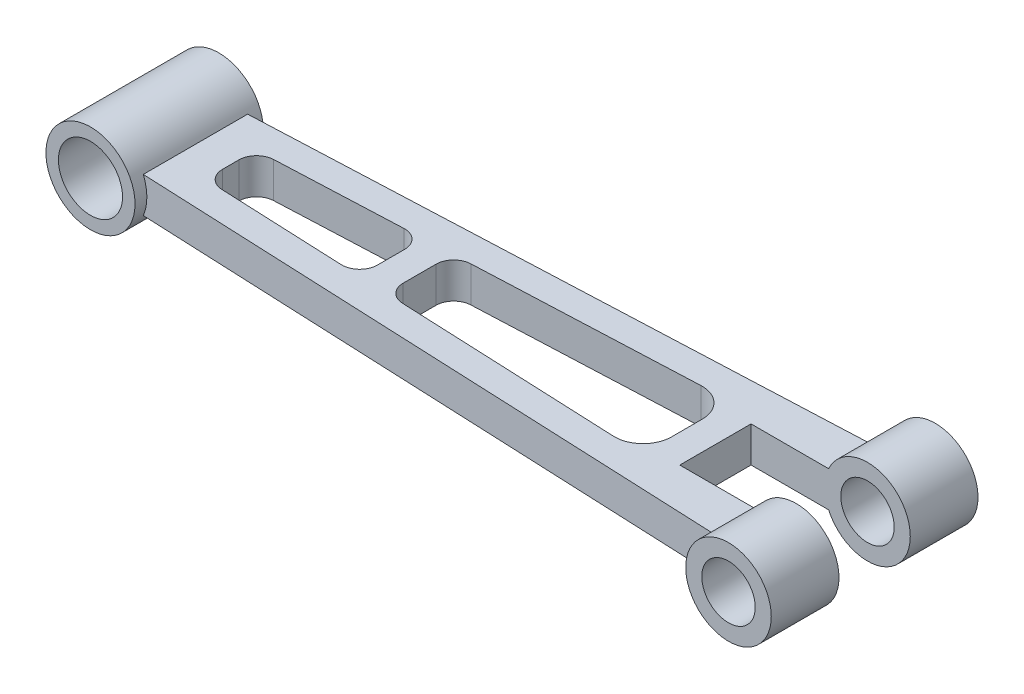
from build123d import *

# Parameters (mm, degrees)
SKETCH1_R           = 12.5
BOSS_EXTRUDE1_DEPTH = 18
SKETCH2_R           = 12
BOSS_EXTRUDE2_DEPTH = 29
BOSS_EXTRUDE4_DEPTH = 5
SKETCH7_W           = 62.580609479
SKETCH7_H           = 20
CUT_EXTRUDE2_DEPTH  = 62
CUT_EXTRUDE3_DEPTH  = 62
SKETCH9_R           = 9
SKETCH9_R_2         = 7.5
CUT_EXTRUDE4_DEPTH  = 62


with BuildPart() as part:
    # Sketch1 → Boss-Extrude1 (new, symmetric)
    with BuildSketch(Plane.XY):
        with Locations((-95, 0)):
            Circle(SKETCH1_R)
    extrude(amount=BOSS_EXTRUDE1_DEPTH, both=True)



with BuildPart() as body_2:
    # Sketch2 → Boss-Extrude2 (new, symmetric)
    with BuildSketch(Plane.XY):
        with Locations(Location((95, 0, 0), (0, 0, 180))):
            Circle(SKETCH2_R)
    extrude(amount=BOSS_EXTRUDE2_DEPTH, both=True)


with BuildPart() as part_1:
    add(part.part)

    add(body_2.part)  # Boss-Extrude4 merges body 2
    # Sketch6 → Boss-Extrude4 (add, symmetric)
    with BuildSketch(Plane(origin=(0, 0, 0), x_dir=(1, 0, 0), z_dir=(0, 1, 0))):
        Polygon((95, 22.434972483), (95, -22.434972483), (-95, -14.13939333), (-95, 14.13939333), align=None)
    extrude(amount=BOSS_EXTRUDE4_DEPTH, both=True)

    # Sketch7 → Cut-Extrude2 (cut, symmetric)
    with BuildSketch(Plane(origin=(0, 5, 0), x_dir=(1, 0, 0), z_dir=(0, 1, 0))):
        with Locations((93.62091422, 0)):
            Rectangle(SKETCH7_W, SKETCH7_H)
    extrude(amount=CUT_EXTRUDE2_DEPTH, both=True, mode=Mode.SUBTRACT)

    # Sketch8 → Cut-Extrude3 (cut, symmetric)
    with BuildSketch(Plane(origin=(0, 5, 0), x_dir=(1, 0, 0), z_dir=(0, 1, 0))):
        with BuildLine():
            Line((-68.887487457, -7.271868768), (-33.887487457, -8.80000177))
            ThreePointArc((-33.887487457, -8.80000177), (-30.211825242, -7.416580473), (-28.66939052, -3.804760662))
            Line((-28.66939052, -3.804760662), (-28.66939052, 3.804760662))
            ThreePointArc((-28.66939052, 3.804760662), (-30.211825242, 7.416580473), (-33.887487457, 8.80000177))
            Line((-33.887487457, 8.80000177), (-68.887487457, 7.271868768))
            ThreePointArc((-68.887487457, 7.271868768), (-72.281210331, 5.734192939), (-73.66939052, 2.276627661))
            Line((-73.66939052, 2.276627661), (-73.66939052, -2.276627661))
            ThreePointArc((-73.66939052, -2.276627661), (-72.281210331, -5.734192939), (-68.887487457, -7.271868768))
        make_face()
        with BuildLine():
            Line((-20.66939052, 4.590657635), (-20.66939052, -4.590657635))
            ThreePointArc((-20.66939052, -4.590657635), (-19.281210331, -8.048222914), (-15.887487457, -9.585898743))
            Line((-15.887487457, -9.585898743), (45.981654381, -12.287163812))
            ThreePointArc((45.981654381, -12.287163812), (51.862713926, -10.073689736), (54.33060948, -4.29477804))
            Line((54.33060948, -4.29477804), (54.33060948, 4.29477804))
            ThreePointArc((54.33060948, 4.29477804), (51.862713926, 10.073689736), (45.981654381, 12.287163812))
            Line((45.981654381, 12.287163812), (-15.887487457, 9.585898743))
            ThreePointArc((-15.887487457, 9.585898743), (-19.281210331, 8.048222914), (-20.66939052, 4.590657635))
        make_face()
    extrude(amount=CUT_EXTRUDE3_DEPTH, both=True, mode=Mode.SUBTRACT)

    # Sketch9 → Cut-Extrude4 (cut, symmetric)
    with BuildSketch(Plane.XY):
        with Locations((-95, 0)):
            Circle(SKETCH9_R)
        with Locations((95, 0)):
            Circle(SKETCH9_R_2)
    extrude(amount=CUT_EXTRUDE4_DEPTH, both=True, mode=Mode.SUBTRACT)


solid = part_1.part
